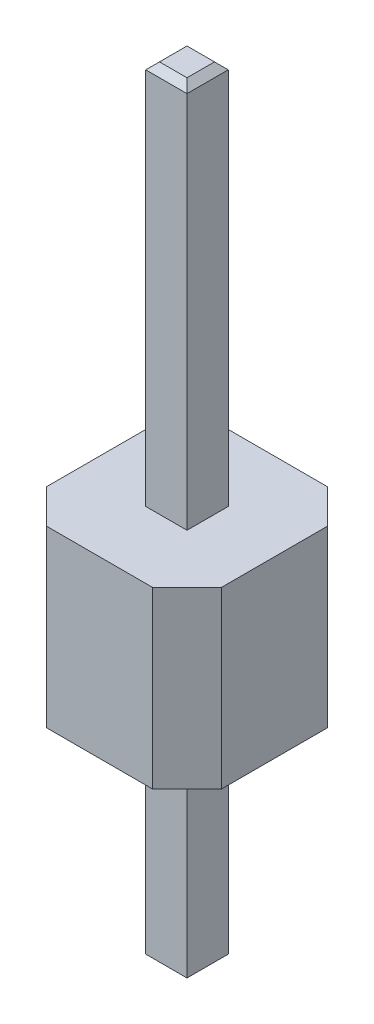
from build123d import *

# Parameters (mm, degrees)
SKETCH_1_W          = 2.54
SKETCH_1_H          = 2.54
EXTRUDE_1_DEPTH     = 2.54
SKETCH_2_W          = 0.6
SKETCH_2_H          = 0.6
EXTRUDE_2_DEPTH     = 5.6
SKETCH_3_W          = 0.6
SKETCH_3_H          = 0.6
EXTRUDE_3_DEPTH     = 3.2
CHAMFER_1_SIZE      = 0.1
CHAMFER_2_SIZE      = 0.5
SKETCH_4_R          = 0.041822452
CUT_EXTRUDE_1_DEPTH = 10


with BuildPart() as part:
    # 草图1 → 凸台-拉伸1 (new body)
    with BuildSketch(Plane(origin=(0, 0, 0), x_dir=(1, 0, 0), z_dir=(0, 1, 0))):
        Rectangle(SKETCH_1_W, SKETCH_1_H)
    extrude(amount=EXTRUDE_1_DEPTH)

    # 草图2 → 凸台-拉伸2 (add)
    with BuildSketch(Plane(origin=(0, 2.54, 0), x_dir=(1, 0, 0), z_dir=(0, 1, 0))):
        Rectangle(SKETCH_2_W, SKETCH_2_H)
    extrude(amount=EXTRUDE_2_DEPTH)

    # 草图3 → 凸台-拉伸3 (add)
    with BuildSketch(Plane.XZ):
        Rectangle(SKETCH_3_W, SKETCH_3_H)
    extrude(amount=EXTRUDE_3_DEPTH)

    # 倒角1
    chamfer_1_edges = [part.edges().sort_by_distance(p)[0] for p in [
        (0.3, 8.14, 0),
        (0, 8.14, -0.3),
        (-0.3, 8.14, 0),
        (0, 8.14, 0.3),
        (-0.3, -3.2, 0),
        (0, -3.2, -0.3),
        (0.3, -3.2, 0),
        (0, -3.2, 0.3),
    ]]
    chamfer(chamfer_1_edges, length=CHAMFER_1_SIZE)

    # 倒角2
    chamfer_2_edges = [part.edges().sort_by_distance(p)[0] for p in [
        (1.27, 1.27, 1.27),
        (-1.27, 1.27, 1.27),
        (-1.27, 1.27, -1.27),
        (1.27, 1.27, -1.27),
    ]]
    chamfer(chamfer_2_edges, length=CHAMFER_2_SIZE)

    # 草图4 → 切除-拉伸1 (cut)
    with BuildSketch(Plane.XZ.offset(3.2)):
        with Locations(Location((0, 0, 0), (0, 0, 270))):
            Circle(SKETCH_4_R)
    extrude(amount=-CUT_EXTRUDE_1_DEPTH, mode=Mode.SUBTRACT)


solid = part.part
